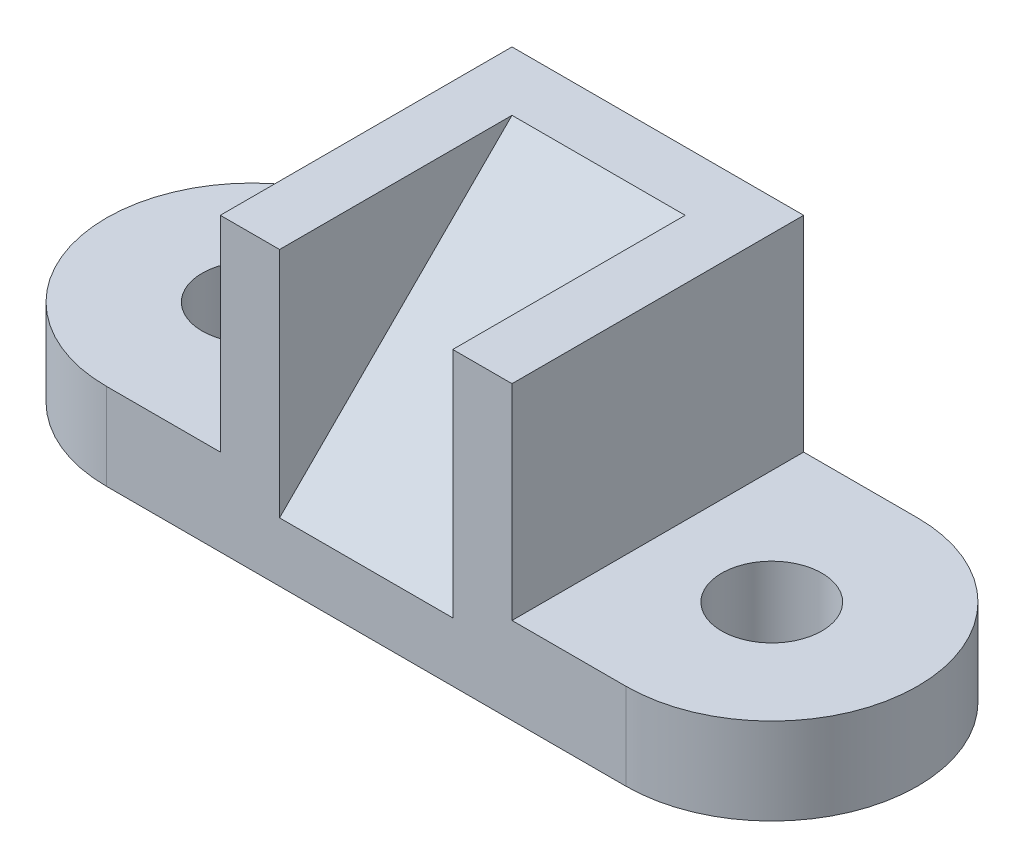
from build123d import *

# Parameters (mm, degrees)
SKETCH1_R           = 11
BOSS_EXTRUDE1_DEPTH = 19
SKETCH2_W           = 64
SKETCH2_H           = 64
BOSS_EXTRUDE2_DEPTH = 45
CUT_EXTRUDE1_START  = -13
CUT_EXTRUDE1_DEPTH  = 38


with BuildPart() as part:
    # Sketch1 → Boss-Extrude1 (new body)
    with BuildSketch(Plane(origin=(0, 0, 0), x_dir=(1, 0, 0), z_dir=(0, 1, 0))):
        with BuildLine():
            Line((-57, 32), (57, 32))
            ThreePointArc((57, 32), (89, 0), (57, -32))
            Line((57, -32), (-57, -32))
            ThreePointArc((-57, -32), (-89, 0), (-57, 32))
        make_face()
        with Locations(Location((-57, 0, 0), (0, 0, 270))):
            Circle(SKETCH1_R, mode=Mode.SUBTRACT)
        with Locations(Location((57, 0, 0), (0, 0, 270))):
            Circle(SKETCH1_R, mode=Mode.SUBTRACT)
    extrude(amount=BOSS_EXTRUDE1_DEPTH)

    # Sketch2 → Boss-Extrude2 (add)
    with BuildSketch(Plane(origin=(0, 19, 0), x_dir=(1, 0, 0), z_dir=(0, 1, 0))):
        Rectangle(SKETCH2_W, SKETCH2_H)
    extrude(amount=BOSS_EXTRUDE2_DEPTH)

    # Sketch4 → Cut-Extrude1 (cut)
    with BuildSketch(Plane.ZY.offset(32).offset(CUT_EXTRUDE1_START)):
        Polygon((-19, 64), (32, 13), (32, 64), align=None)
    extrude(amount=-CUT_EXTRUDE1_DEPTH, mode=Mode.SUBTRACT)


solid = part.part
